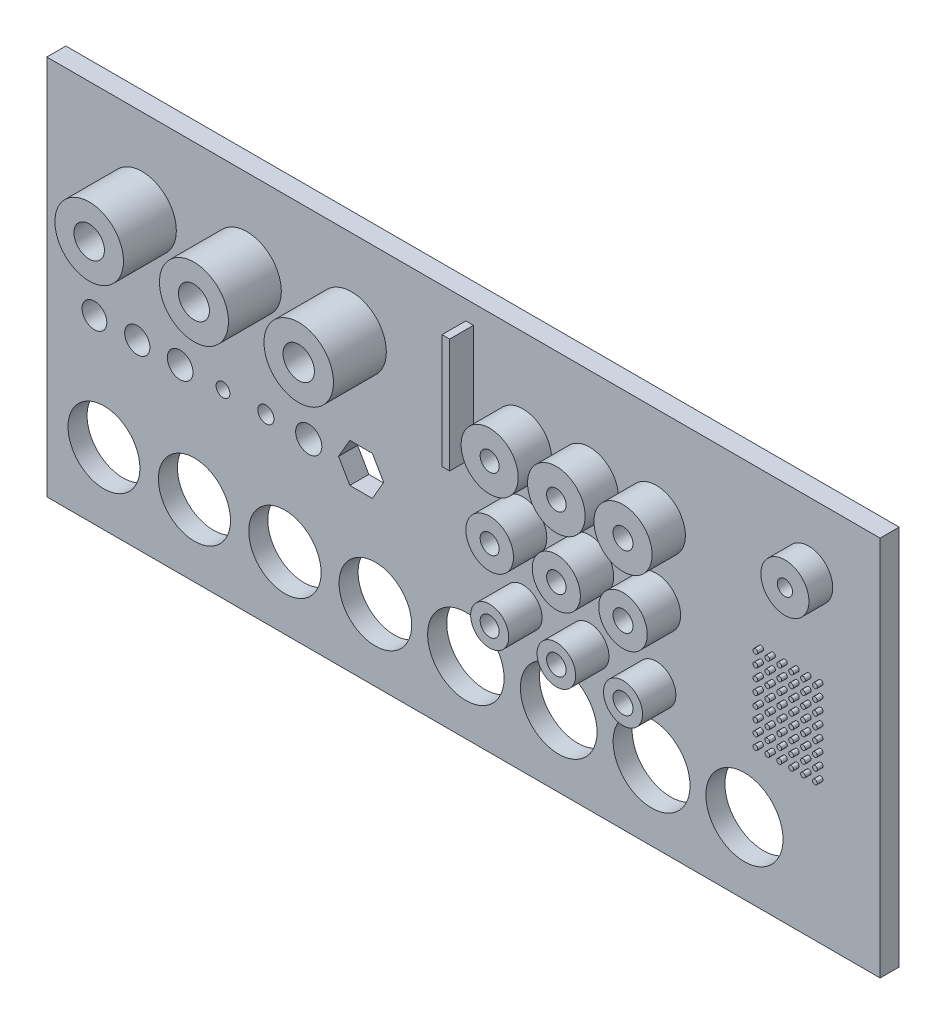
from build123d import *

# Parameters (mm, degrees)
SKETCH1_W            = 175
SKETCH1_H            = 80
SKETCH1_R            = 7.55
SKETCH1_R_2          = 7.575
SKETCH1_R_3          = 7.6
SKETCH1_R_4          = 7.625
SKETCH1_R_5          = 8.025
SKETCH1_R_6          = 8.05
SKETCH1_R_7          = 8.075
SKETCH1_R_8          = 8.1
SKETCH1_R_9          = 2.6
SKETCH1_R_10         = 2.65
SKETCH1_R_11         = 2.7
SKETCH1_R_12         = 1.45
SKETCH1_R_13         = 1.7
SKETCH1_R_14         = 2.75
BOSS_EXTRUDE1_DEPTH  = 4
SKETCH2_R            = 4
SKETCH2_R_2          = 2
BOSS_EXTRUDE2_DEPTH  = 7
SKETCH3_R            = 5
SKETCH3_R_2          = 2
BOSS_EXTRUDE3_DEPTH  = 7
SKETCH4_R            = 6
SKETCH4_R_2          = 2
BOSS_EXTRUDE4_DEPTH  = 7
SKETCH5_R            = 4.05
SKETCH5_R_2          = 2.05
BOSS_EXTRUDE5_DEPTH  = 7
SKETCH6_R            = 5.05
SKETCH6_R_2          = 2.05
BOSS_EXTRUDE6_DEPTH  = 7
SKETCH7_R            = 6.05
SKETCH7_R_2          = 2.05
BOSS_EXTRUDE7_DEPTH  = 7
SKETCH8_R            = 4.1
SKETCH8_R_2          = 2.1
BOSS_EXTRUDE8_DEPTH  = 7
SKETCH9_R            = 5.1
SKETCH9_R_2          = 2.1
BOSS_EXTRUDE9_DEPTH  = 7
SKETCH10_R           = 6.1
SKETCH10_R_2         = 2.1
BOSS_EXTRUDE10_DEPTH = 7
SKETCH11_R           = 7.2
SKETCH11_R_2         = 3.2
BOSS_EXTRUDE11_DEPTH = 11.1
SKETCH12_R           = 7.25
SKETCH12_R_2         = 3.25
BOSS_EXTRUDE12_DEPTH = 11.1
SKETCH13_R           = 7.3
SKETCH13_R_2         = 3.3
BOSS_EXTRUDE13_DEPTH = 11.1
SKETCH14_W           = 1.6
SKETCH14_H           = 24
BOSS_EXTRUDE14_DEPTH = 5
SKETCH15_R           = 0.5
BOSS_EXTRUDE15_DEPTH = 1.2
SKETCH16_R           = 1.6
CUT_EXTRUDE1_DEPTH   = 4
SKETCH17_R           = 5.05
SKETCH17_R_2         = 1.6
BOSS_EXTRUDE16_DEPTH = 5


with BuildPart() as part:
    # Sketch1 → Boss-Extrude1 (new body)
    with BuildSketch(Plane.XY.offset(300)):
        with Locations((387.5, 340)):
            Rectangle(SKETCH1_W, SKETCH1_H)
        with Locations((312, 315)):
            Circle(SKETCH1_R, mode=Mode.SUBTRACT)
        with Locations((331, 315)):
            Circle(SKETCH1_R_2, mode=Mode.SUBTRACT)
        with Locations((350, 315)):
            Circle(SKETCH1_R_3, mode=Mode.SUBTRACT)
        with Locations((369, 315)):
            Circle(SKETCH1_R_4, mode=Mode.SUBTRACT)
        with Locations((388, 315)):
            Circle(SKETCH1_R_5, mode=Mode.SUBTRACT)
        with Locations((407.5, 315)):
            Circle(SKETCH1_R_6, mode=Mode.SUBTRACT)
        with Locations((427, 315)):
            Circle(SKETCH1_R_7, mode=Mode.SUBTRACT)
        with Locations((446.5, 315)):
            Circle(SKETCH1_R_8, mode=Mode.SUBTRACT)
        with Locations((310, 338)):
            Circle(SKETCH1_R_9, mode=Mode.SUBTRACT)
        with Locations((319, 338)):
            Circle(SKETCH1_R_10, mode=Mode.SUBTRACT)
        with Locations((328, 338)):
            Circle(SKETCH1_R_11, mode=Mode.SUBTRACT)
        with Locations((337, 338)):
            Circle(SKETCH1_R_12, mode=Mode.SUBTRACT)
        with Locations((346, 338)):
            Circle(SKETCH1_R_13, mode=Mode.SUBTRACT)
        with Locations((355, 338)):
            Circle(SKETCH1_R_14, mode=Mode.SUBTRACT)
        Polygon((370.734272207, 338), (368.367136104, 342.1), (363.632863896, 342.1), (361.265727793, 338), (363.632863896, 333.9), (368.367136104, 333.9), align=None, mode=Mode.SUBTRACT)
    extrude(amount=BOSS_EXTRUDE1_DEPTH)

    # Sketch2 → Boss-Extrude2 (add)
    with BuildSketch(Plane.XY.offset(304)):
        with Locations((400, 330)):
            Circle(SKETCH2_R)
        with Locations((400, 330)):
            Circle(SKETCH2_R_2, mode=Mode.SUBTRACT)
    extrude(amount=BOSS_EXTRUDE2_DEPTH)

    # Sketch3 → Boss-Extrude3 (add)
    with BuildSketch(Plane.XY.offset(304)):
        with Locations((400, 345)):
            Circle(SKETCH3_R)
        with Locations((400, 345)):
            Circle(SKETCH3_R_2, mode=Mode.SUBTRACT)
    extrude(amount=BOSS_EXTRUDE3_DEPTH)

    # Sketch4 → Boss-Extrude4 (add)
    with BuildSketch(Plane.XY.offset(304)):
        with Locations((400, 360)):
            Circle(SKETCH4_R)
        with Locations((400, 360)):
            Circle(SKETCH4_R_2, mode=Mode.SUBTRACT)
    extrude(amount=BOSS_EXTRUDE4_DEPTH)

    # Sketch5 → Boss-Extrude5 (add)
    with BuildSketch(Plane.XY.offset(304)):
        with Locations((414, 330)):
            Circle(SKETCH5_R)
        with Locations((414, 330)):
            Circle(SKETCH5_R_2, mode=Mode.SUBTRACT)
    extrude(amount=BOSS_EXTRUDE5_DEPTH)

    # Sketch6 → Boss-Extrude6 (add)
    with BuildSketch(Plane.XY.offset(304)):
        with Locations((414, 345)):
            Circle(SKETCH6_R)
        with Locations((414, 345)):
            Circle(SKETCH6_R_2, mode=Mode.SUBTRACT)
    extrude(amount=BOSS_EXTRUDE6_DEPTH)

    # Sketch7 → Boss-Extrude7 (add)
    with BuildSketch(Plane.XY.offset(304)):
        with Locations((414, 360)):
            Circle(SKETCH7_R)
        with Locations((414, 360)):
            Circle(SKETCH7_R_2, mode=Mode.SUBTRACT)
    extrude(amount=BOSS_EXTRUDE7_DEPTH)

    # Sketch8 → Boss-Extrude8 (add)
    with BuildSketch(Plane.XY.offset(304)):
        with Locations((428, 330)):
            Circle(SKETCH8_R)
        with Locations((428, 330)):
            Circle(SKETCH8_R_2, mode=Mode.SUBTRACT)
    extrude(amount=BOSS_EXTRUDE8_DEPTH)

    # Sketch9 → Boss-Extrude9 (add)
    with BuildSketch(Plane.XY.offset(304)):
        with Locations((428, 345)):
            Circle(SKETCH9_R)
        with Locations((428, 345)):
            Circle(SKETCH9_R_2, mode=Mode.SUBTRACT)
    extrude(amount=BOSS_EXTRUDE9_DEPTH)

    # Sketch10 → Boss-Extrude10 (add)
    with BuildSketch(Plane.XY.offset(304)):
        with Locations((428, 360)):
            Circle(SKETCH10_R)
        with Locations((428, 360)):
            Circle(SKETCH10_R_2, mode=Mode.SUBTRACT)
    extrude(amount=BOSS_EXTRUDE10_DEPTH)

    # Sketch11 → Boss-Extrude11 (add)
    with BuildSketch(Plane.XY.offset(304)):
        with Locations((320, 362)):
            Circle(SKETCH11_R)
        with Locations((320, 362)):
            Circle(SKETCH11_R_2, mode=Mode.SUBTRACT)
    extrude(amount=BOSS_EXTRUDE11_DEPTH)

    # Sketch12 → Boss-Extrude12 (add)
    with BuildSketch(Plane.XY.offset(304)):
        with Locations((342, 362)):
            Circle(SKETCH12_R)
        with Locations((342, 362)):
            Circle(SKETCH12_R_2, mode=Mode.SUBTRACT)
    extrude(amount=BOSS_EXTRUDE12_DEPTH)

    # Sketch13 → Boss-Extrude13 (add)
    with BuildSketch(Plane.XY.offset(304)):
        with Locations((364, 362)):
            Circle(SKETCH13_R)
        with Locations((364, 362)):
            Circle(SKETCH13_R_2, mode=Mode.SUBTRACT)
    extrude(amount=BOSS_EXTRUDE13_DEPTH)

    # Sketch14 → Boss-Extrude14 (add)
    with BuildSketch(Plane.XY.offset(304)):
        with Locations((388.8, 364)):
            Rectangle(SKETCH14_W, SKETCH14_H)
    extrude(amount=BOSS_EXTRUDE14_DEPTH)

    # Sketch15 → Boss-Extrude15 (add)
    with BuildSketch(Plane.XY.offset(304)):
        with Locations((450, 330)):
            Circle(SKETCH15_R)
        with Locations((452.5, 330)):
            Circle(SKETCH15_R)
        with Locations((455, 330)):
            Circle(SKETCH15_R)
        with Locations((457.5, 330)):
            Circle(SKETCH15_R)
        with Locations((460, 330)):
            Circle(SKETCH15_R)
        with Locations((462.5, 330)):
            Circle(SKETCH15_R)
        with Locations((450, 332.5)):
            Circle(SKETCH15_R)
        with Locations((452.5, 332.5)):
            Circle(SKETCH15_R)
        with Locations((455, 332.5)):
            Circle(SKETCH15_R)
        with Locations((457.5, 332.5)):
            Circle(SKETCH15_R)
        with Locations((460, 332.5)):
            Circle(SKETCH15_R)
        with Locations((462.5, 332.5)):
            Circle(SKETCH15_R)
        with Locations((450, 335)):
            Circle(SKETCH15_R)
        with Locations((452.5, 335)):
            Circle(SKETCH15_R)
        with Locations((455, 335)):
            Circle(SKETCH15_R)
        with Locations((457.5, 335)):
            Circle(SKETCH15_R)
        with Locations((460, 335)):
            Circle(SKETCH15_R)
        with Locations((462.5, 335)):
            Circle(SKETCH15_R)
        with Locations((450, 337.5)):
            Circle(SKETCH15_R)
        with Locations((452.5, 337.5)):
            Circle(SKETCH15_R)
        with Locations((455, 337.5)):
            Circle(SKETCH15_R)
        with Locations((457.5, 337.5)):
            Circle(SKETCH15_R)
        with Locations((460, 337.5)):
            Circle(SKETCH15_R)
        with Locations((462.5, 337.5)):
            Circle(SKETCH15_R)
        with Locations((450, 340)):
            Circle(SKETCH15_R)
        with Locations((452.5, 340)):
            Circle(SKETCH15_R)
        with Locations((455, 340)):
            Circle(SKETCH15_R)
        with Locations((457.5, 340)):
            Circle(SKETCH15_R)
        with Locations((460, 340)):
            Circle(SKETCH15_R)
        with Locations((462.5, 340)):
            Circle(SKETCH15_R)
        with Locations((450, 342.5)):
            Circle(SKETCH15_R)
        with Locations((452.5, 342.5)):
            Circle(SKETCH15_R)
        with Locations((455, 342.5)):
            Circle(SKETCH15_R)
        with Locations((457.5, 342.5)):
            Circle(SKETCH15_R)
        with Locations((460, 342.5)):
            Circle(SKETCH15_R)
        with Locations((462.5, 342.5)):
            Circle(SKETCH15_R)
        with Locations((450, 345)):
            Circle(SKETCH15_R)
        with Locations((452.5, 345)):
            Circle(SKETCH15_R)
        with Locations((455, 345)):
            Circle(SKETCH15_R)
        with Locations((457.5, 345)):
            Circle(SKETCH15_R)
        with Locations((460, 345)):
            Circle(SKETCH15_R)
        with Locations((462.5, 345)):
            Circle(SKETCH15_R)
        with Locations((450, 347.5)):
            Circle(SKETCH15_R)
        with Locations((452.5, 347.5)):
            Circle(SKETCH15_R)
        with Locations((455, 347.5)):
            Circle(SKETCH15_R)
        with Locations((457.5, 347.5)):
            Circle(SKETCH15_R)
        with Locations((460, 347.5)):
            Circle(SKETCH15_R)
        with Locations((462.5, 347.5)):
            Circle(SKETCH15_R)
    extrude(amount=BOSS_EXTRUDE15_DEPTH)

    # Sketch16 → Cut-Extrude1 (cut)
    with BuildSketch(Plane.XY.offset(300)):
        with Locations((460, 366)):
            Circle(SKETCH16_R)
    extrude(amount=CUT_EXTRUDE1_DEPTH, mode=Mode.SUBTRACT)

    # Sketch17 → Boss-Extrude16 (add)
    with BuildSketch(Plane.XY.offset(304)):
        with Locations((460, 366)):
            Circle(SKETCH17_R)
        with Locations((460, 366)):
            Circle(SKETCH17_R_2, mode=Mode.SUBTRACT)
    extrude(amount=BOSS_EXTRUDE16_DEPTH)


solid = part.part
